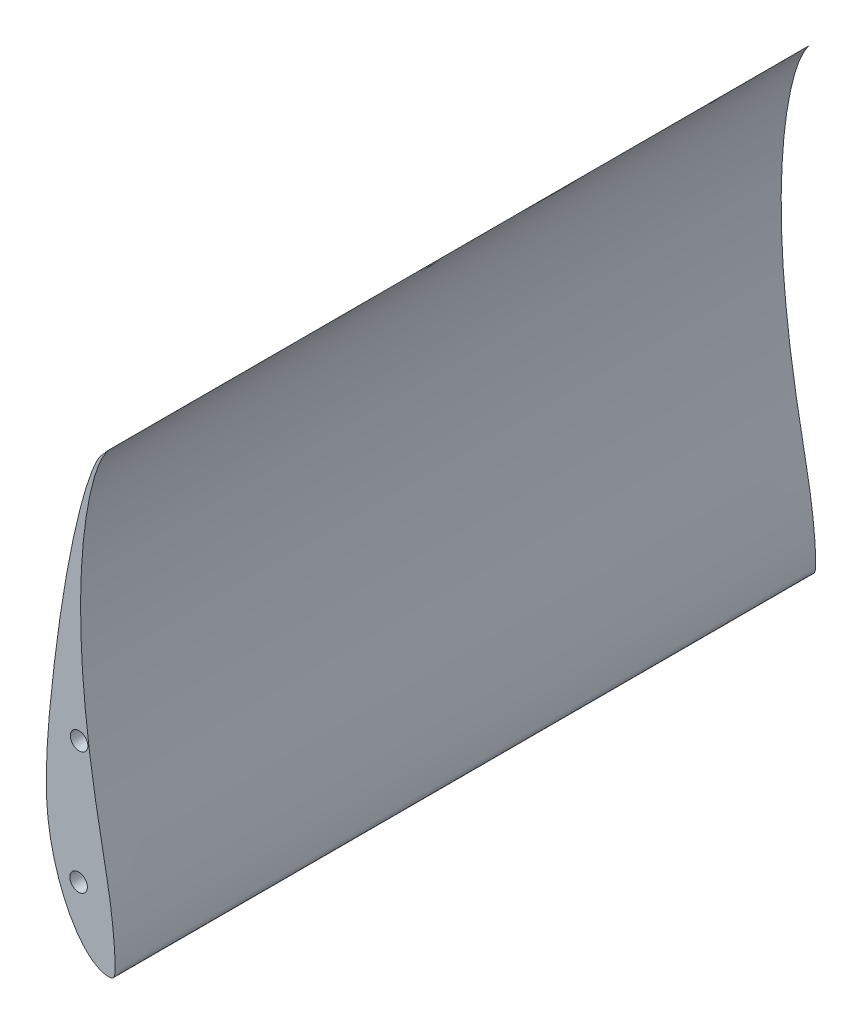
from build123d import *

# Parameters (mm, degrees)
SKETCH1_R           = 5
BOSS_EXTRUDE1_DEPTH = 400


with BuildPart() as part:
    # Sketch1 → Boss-Extrude1 (new body)
    with BuildSketch(Plane.XY):
        with BuildLine():
            add(Edge.make_bspline(
                [(15.517876647, 129.912518558), (15.511257776, 129.914075077), (14.874436484, 129.059359543), (14.165193341, 128.336507436), (12.683799366, 126.731483761), (11.107879445, 124.837931088), (9.519176821, 122.247713673), (7.979544376, 119.02675863), (6.372751432, 115.138307858), (4.721171095, 110.588288499), (3.036470553, 105.39792775), (1.333277023, 99.594170585), (-0.380415524, 93.209516427), (-2.088872116, 86.279218577), (-3.779725319, 78.84301024), (-5.442414074, 70.945213053), (-7.068390891, 62.634054628), (-8.637647165, 53.958109953), (-10.147940879, 44.972013084), (-11.579824096, 35.727551614), (-12.93609285, 26.284509714), (-14.205999388, 16.70340601), (-15.385480077, 7.053636481), (-16.48288628, -2.587656285), (-17.470527605, -12.140656744), (-18.329919221, -21.527538063), (-19.012689875, -30.682280591), (-19.482348454, -39.552589078), (-19.685168912, -48.089115098), (-19.663579999, -56.248127241), (-19.264090909, -64.014405795), (-18.454544264, -71.390959203), (-17.309833303, -78.407815763), (-15.826870359, -85.066669001), (-14.087889444, -91.360677915), (-12.123690573, -97.263211777), (-9.980206607, -102.749167654), (-7.668921547, -107.784455173), (-5.236761127, -112.352926407), (-2.71138371, -116.429727372), (-0.127010351, -119.989292026), (2.46158003, -123.030151698), (5.082643842, -125.508208579), (7.713482616, -127.411672344), (10.27293838, -128.817713087), (12.703020365, -129.718836405), (14.945985302, -130.148221709), (16.843001997, -130.065338725), (18.582871983, -129.57694438), (19.44655619, -127.761504397), (19.567728364, -125.320621502), (19.685168912, -121.981502801), (19.504091564, -117.782325375), (19.171326581, -112.770548223), (18.638309237, -107.001947193), (17.917113852, -100.53555106), (16.992264876, -93.402891671), (15.699650819, -85.60745465), (14.078733744, -77.111284684), (12.314658717, -67.871906642), (10.452048399, -57.93448185), (8.568213797, -47.361427786), (6.733853015, -36.23039334), (5.010220159, -24.627733849), (3.460544284, -12.653440497), (2.12994821, -0.415194752), (1.078166801, 11.971397296), (0.332583473, 24.382033144), (-0.077304981, 36.687053504), (-0.129076829, 48.752970499), (0.180785583, 60.445169928), (0.845028316, 71.629769179), (1.855080849, 82.172275032), (3.172172432, 91.947172642), (4.758086028, 100.827195971), (6.559707429, 108.708230678), (8.487522589, 115.445032915), (10.545053357, 120.958410783), (12.427957426, 124.892063969), (14.168953773, 127.792241452), (14.842690639, 128.906364929), (15.524630079, 129.910930395), (15.517876647, 129.912518558)],
                knots=[0, 0, 0, 0, 0.000979678, 0.003648862, 0.007483499, 0.012095277, 0.017525591, 0.02405178, 0.031783051, 0.040677828, 0.050710301, 0.061833229, 0.07398925, 0.087118173, 0.101145049, 0.115990637, 0.131570422, 0.147788379, 0.164550917, 0.181757895, 0.199311955, 0.217095072, 0.234990228, 0.252856883, 0.270540594, 0.287886779, 0.304773438, 0.321101419, 0.336806063, 0.351800033, 0.366031063, 0.379615675, 0.392652963, 0.405170359, 0.417171919, 0.428603517, 0.439418959, 0.449596586, 0.459102079, 0.467907878, 0.475988301, 0.483308969, 0.489874508, 0.49580325, 0.501149412, 0.505903073, 0.510046769, 0.513579311, 0.516446927, 0.519350053, 0.523823355, 0.529973794, 0.537715654, 0.546967844, 0.557637367, 0.569620481, 0.582804124, 0.597246961, 0.613135037, 0.6304436, 0.649056124, 0.668822257, 0.689594964, 0.711189651, 0.733426689, 0.756094118, 0.778988554, 0.801889683, 0.824566598, 0.846792285, 0.868338291, 0.888978163, 0.908492011, 0.926658768, 0.943286193, 0.95816921, 0.971135822, 0.981955623, 0.990251791, 0.995852565, 0.999000406, 1, 1, 1, 1], degree=3))
        make_face()
        with Locations((-1.22298963, -91.855588497)):
            Circle(SKETCH1_R, mode=Mode.SUBTRACT)
        with Locations((-0.931130189, -21.855588497)):
            Circle(SKETCH1_R, mode=Mode.SUBTRACT)
    extrude(amount=BOSS_EXTRUDE1_DEPTH)


solid = part.part
